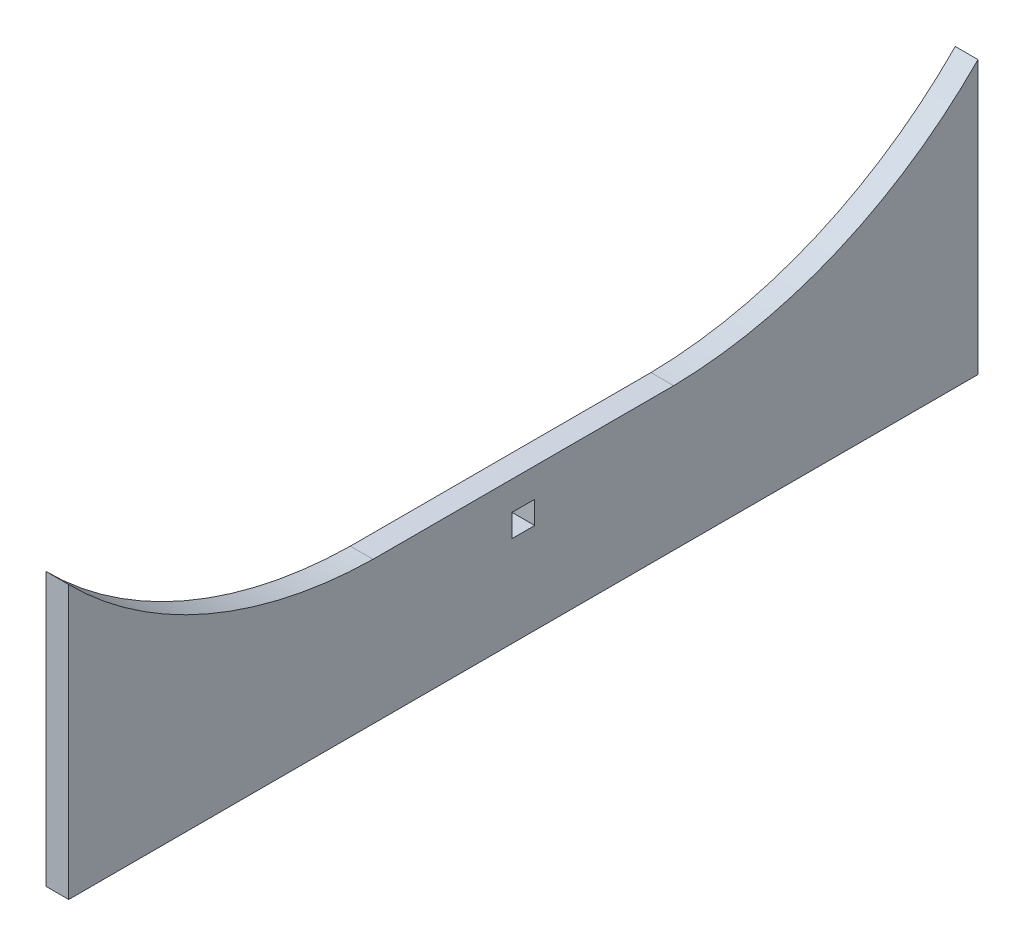
from build123d import *

# Parameters (mm, degrees)
SKETCH1_W           = 6.35
SKETCH1_H           = 6.35
BOSS_EXTRUDE1_DEPTH = 6.35


with BuildPart() as part:
    # Sketch1 → Boss-Extrude1 (new body)
    with BuildSketch(Plane(origin=(0, 0, 0), x_dir=(0, 0, -1), z_dir=(1, 0, 0))):
        with BuildLine():
            Line((-42, 1.711410462), (42, 1.711410462))
            ThreePointArc((42, 1.711410462), (88.07418015, 11.556788259), (127, 38.1))
            Line((127, 38.1), (127, -38.1))
            Line((127, -38.1), (-127, -38.1))
            Line((-127, -38.1), (-127, 38.1))
            ThreePointArc((-127, 38.1), (-88.07418015, 11.556788259), (-42, 1.711410462))
        make_face()
        with Locations((0, -9.525)):
            Rectangle(SKETCH1_W, SKETCH1_H, mode=Mode.SUBTRACT)
    extrude(amount=BOSS_EXTRUDE1_DEPTH)


solid = part.part
